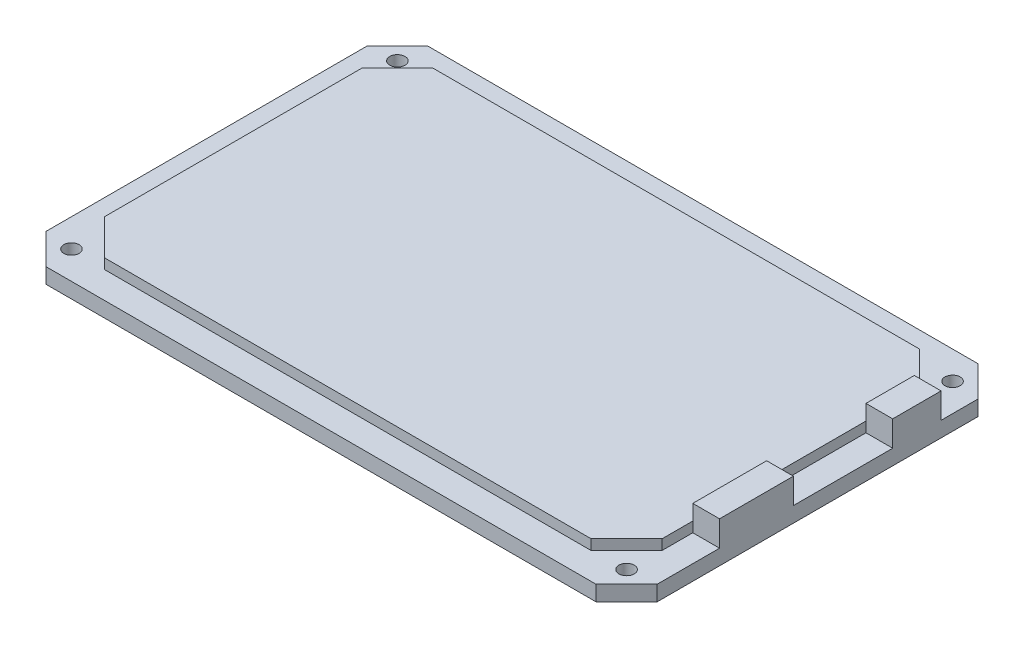
from build123d import *

# Parameters (mm, degrees)
SKETCH1_W           = 120
SKETCH1_H           = 75
BOSS_EXTRUDE1_DEPTH = 3
CHAMFER1_SIZE       = 6
SKETCH2_W           = 109.5
SKETCH2_H           = 64.5
BOSS_EXTRUDE2_DEPTH = 2
CHAMFER2_SIZE       = 7
SKETCH3_R           = 1.5
CUT_EXTRUDE1_DEPTH  = 5
SKETCH4_W           = 5.25
SKETCH4_H           = 9.5
SKETCH4_H_2         = 14.5
BOSS_EXTRUDE3_DEPTH = 5


with BuildPart() as part:
    # Sketch1 → Boss-Extrude1 (new body)
    with BuildSketch(Plane(origin=(0, 0, 0), x_dir=(1, 0, 0), z_dir=(0, 1, 0))):
        Rectangle(SKETCH1_W, SKETCH1_H)
    extrude(amount=BOSS_EXTRUDE1_DEPTH)

    # Chamfer1
    chamfer1_edges = [part.edges().sort_by_distance(p)[0] for p in [
        (60, 1.5, 37.5),
        (-60, 1.5, 37.5),
        (-60, 1.5, -37.5),
        (60, 1.5, -37.5),
    ]]
    chamfer(chamfer1_edges, length=CHAMFER1_SIZE)

    # Sketch2 → Boss-Extrude2 (add)
    with BuildSketch(Plane(origin=(0, 3, 0), x_dir=(1, 0, 0), z_dir=(0, 1, 0))):
        Rectangle(SKETCH2_W, SKETCH2_H)
    extrude(amount=BOSS_EXTRUDE2_DEPTH)

    # Chamfer2
    chamfer2_edges = [part.edges().sort_by_distance(p)[0] for p in [
        (54.75, 4, 32.25),
        (54.75, 4, -32.25),
        (-54.75, 4, -32.25),
        (-54.75, 4, 32.25),
    ]]
    chamfer(chamfer2_edges, length=CHAMFER2_SIZE)

    # Sketch3 → Cut-Extrude1 (cut)
    with BuildSketch(Plane(origin=(0, 3, 0), x_dir=(1, 0, 0), z_dir=(0, 1, 0))):
        with Locations(Location((-54.5, -32, 0), (0, 0, 270))):
            Circle(SKETCH3_R)
        with Locations(Location((-54.5, 32, 0), (0, 0, 270))):
            Circle(SKETCH3_R)
        with Locations(Location((54.5, 32, 0), (0, 0, 270))):
            Circle(SKETCH3_R)
        with Locations(Location((54.5, -32, 0), (0, 0, 270))):
            Circle(SKETCH3_R)
    extrude(amount=-CUT_EXTRUDE1_DEPTH, mode=Mode.SUBTRACT)

    # Sketch4 → Boss-Extrude3 (add)
    with BuildSketch(Plane(origin=(0, 3, 0), x_dir=(1, 0, 0), z_dir=(0, 1, 0))):
        with Locations((57.375, 19.5)):
            Rectangle(SKETCH4_W, SKETCH4_H)
        with Locations((57.375, -12)):
            Rectangle(SKETCH4_W, SKETCH4_H_2)
    extrude(amount=BOSS_EXTRUDE3_DEPTH)


solid = part.part
